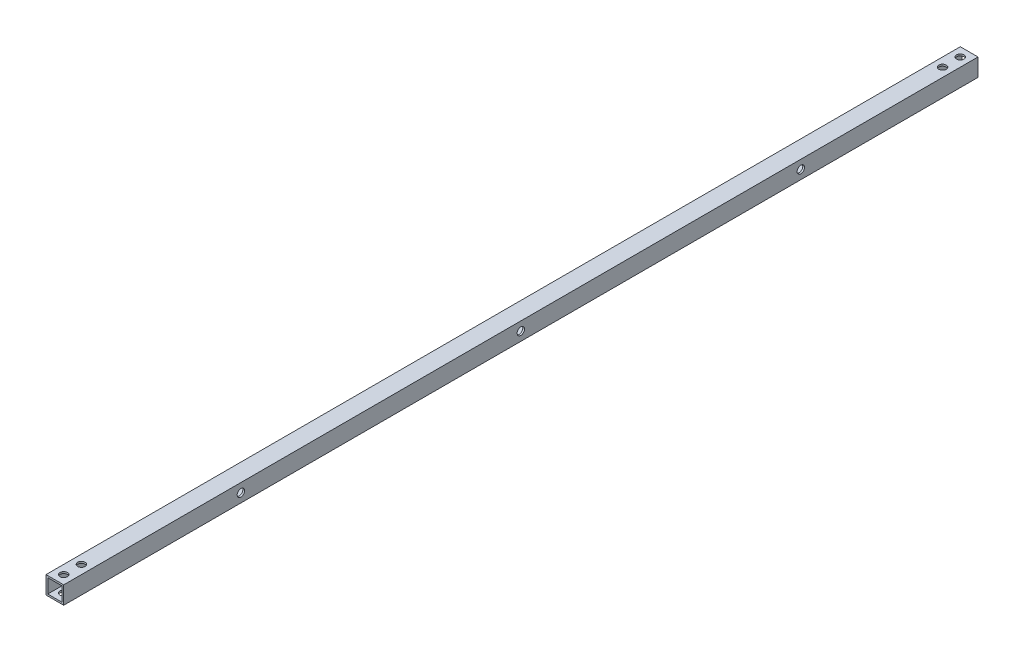
from build123d import *

# Parameters (mm, degrees)
SKETCH1_W           = 10
SKETCH1_H           = 10
SKETCH1_W_2         = 8
SKETCH1_H_2         = 8
BOSS_EXTRUDE1_DEPTH = 516
SKETCH2_R           = 2.1
CUT_EXTRUDE1_DEPTH  = 116
SKETCH3_R           = 2.1
CUT_EXTRUDE2_DEPTH  = 5
SKETCH4_R           = 2.1
CUT_EXTRUDE3_DEPTH  = 10


with BuildPart() as part:
    # Sketch1 → Boss-Extrude1 (new body)
    with BuildSketch(Plane.XY):
        with Locations((5, 5)):
            Rectangle(SKETCH1_W, SKETCH1_H)
        with Locations((5, 5)):
            Rectangle(SKETCH1_W_2, SKETCH1_H_2, mode=Mode.SUBTRACT)
    extrude(amount=BOSS_EXTRUDE1_DEPTH)

    # Sketch2 → Cut-Extrude1 (cut)
    with BuildSketch(Plane(origin=(0, 10, 0), x_dir=(1, 0, 0), z_dir=(0, 1, 0))):
        with Locations(Location((5, -5, 0), (0, 0, 270))):
            Circle(SKETCH2_R)
        with Locations(Location((5, -15, 0), (0, 0, 270))):
            Circle(SKETCH2_R)
        with Locations(Location((5, -501, 0), (0, 0, 270))):
            Circle(SKETCH2_R)
        with Locations(Location((5, -511, 0), (0, 0, 270))):
            Circle(SKETCH2_R)
    extrude(amount=-CUT_EXTRUDE1_DEPTH, mode=Mode.SUBTRACT)

    # Sketch3 → Cut-Extrude2 (cut)
    with BuildSketch(Plane.XZ):
        with Locations(Location((5, 308, 0), (0, 0, 270))):
            Circle(SKETCH3_R)
        with Locations(Location((5, 208, 0), (0, 0, 270))):
            Circle(SKETCH3_R)
    extrude(amount=-CUT_EXTRUDE2_DEPTH, mode=Mode.SUBTRACT)

    # Sketch4 → Cut-Extrude3 (cut)
    with BuildSketch(Plane(origin=(10, 0, 0), x_dir=(0, 0, -1), z_dir=(1, 0, 0))):
        with Locations((-416, 5)):
            Circle(SKETCH4_R)
        with Locations((-100, 5)):
            Circle(SKETCH4_R)
        with Locations((-258, 5)):
            Circle(SKETCH4_R)
    extrude(amount=-CUT_EXTRUDE3_DEPTH, mode=Mode.SUBTRACT)


solid = part.part
